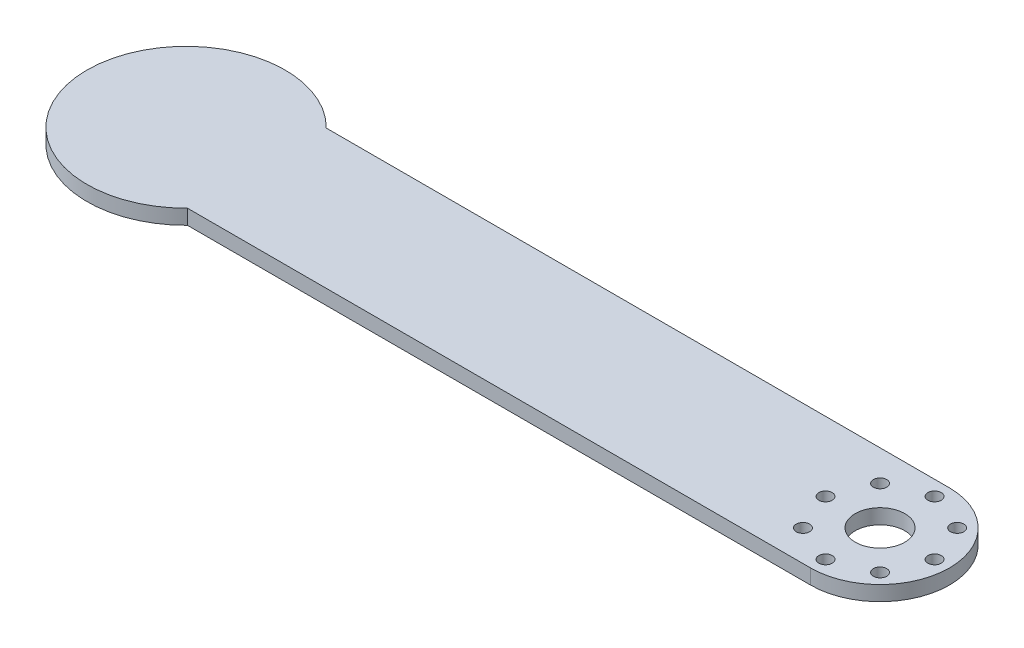
from build123d import *

# Parameters (mm, degrees)
SKETCH_1_R      = 5
SKETCH_1_R_2    = 1.35
EXTRUDE_1_DEPTH = 3


with BuildPart() as part:
    # 草图1 → 凸台-拉伸1 (new body)
    with BuildSketch(Plane(origin=(0, 0, 0), x_dir=(1, 0, 0), z_dir=(0, 1, 0))):
        with BuildLine():
            Line((14.282856857, -14), (140, -14))
            ThreePointArc((140, -14), (154, 0), (140, 14))
            Line((140, 14), (14.282856857, 14))
            ThreePointArc((14.282856857, 14), (-20, 0), (14.282856857, -14))
        make_face()
        with Locations(Location((140, 0, 0), (0, 0, 270))):
            Circle(SKETCH_1_R, mode=Mode.SUBTRACT)
        with Locations(Location((140, 11, 0), (0, 0, 270))):
            Circle(SKETCH_1_R_2, mode=Mode.SUBTRACT)
        with Locations(Location((147.778174593, 7.778174593, 0), (0, 0, 270))):
            Circle(SKETCH_1_R_2, mode=Mode.SUBTRACT)
        with Locations(Location((151, 0, 0), (0, 0, 270))):
            Circle(SKETCH_1_R_2, mode=Mode.SUBTRACT)
        with Locations(Location((147.778174593, -7.778174593, 0), (0, 0, 270))):
            Circle(SKETCH_1_R_2, mode=Mode.SUBTRACT)
        with Locations(Location((140, -11, 0), (0, 0, 270))):
            Circle(SKETCH_1_R_2, mode=Mode.SUBTRACT)
        with Locations(Location((132.221825407, -7.778174593, 0), (0, 0, 270))):
            Circle(SKETCH_1_R_2, mode=Mode.SUBTRACT)
        with Locations(Location((129, 0, 0), (0, 0, 270))):
            Circle(SKETCH_1_R_2, mode=Mode.SUBTRACT)
        with Locations(Location((132.221825407, 7.778174593, 0), (0, 0, 270))):
            Circle(SKETCH_1_R_2, mode=Mode.SUBTRACT)
    extrude(amount=EXTRUDE_1_DEPTH)


solid = part.part
